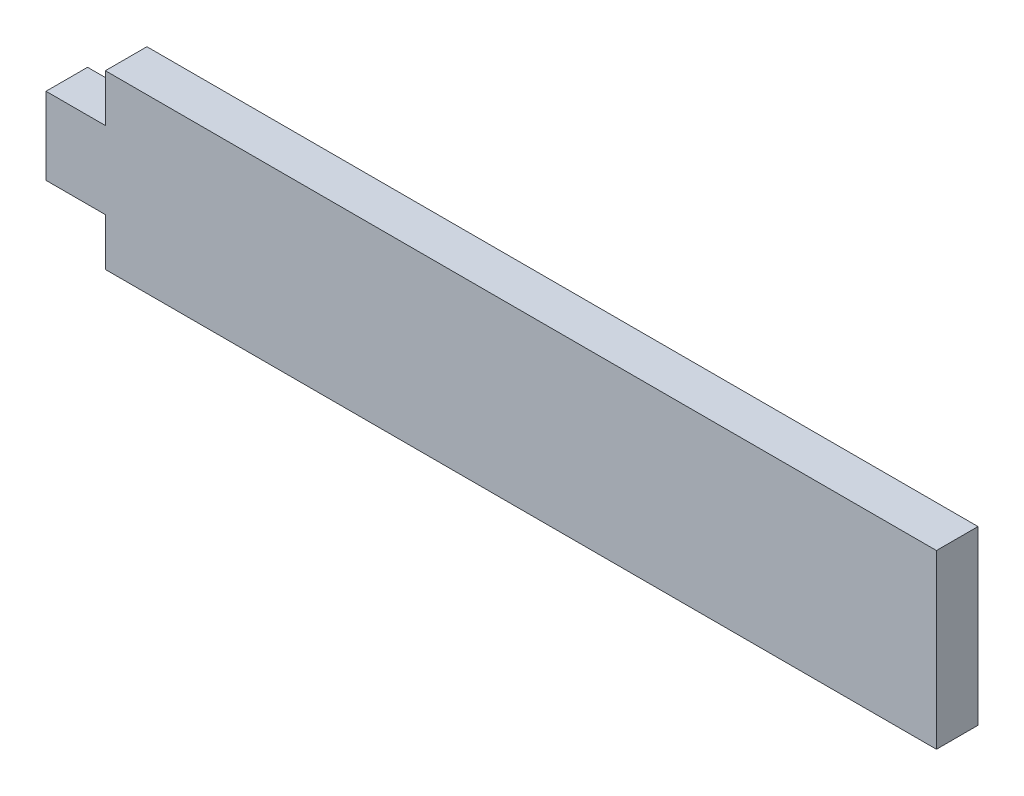
from build123d import *

# Parameters (mm, degrees)
CROQUIS1_W              = 1300
CROQUIS1_H              = 145
SALIENTE_EXTRUIR1_DEPTH = 35
CROQUIS2_W              = 35
CROQUIS2_H              = 145
CORTAR_EXTRUIR1_DEPTH   = 600
CROQUIS3_W              = 35
CROQUIS3_H              = 65
SALIENTE_EXTRUIR2_DEPTH = 50


with BuildPart() as part:
    # Croquis1 → Saliente-Extruir1 (new body)
    with BuildSketch(Plane.XY):
        Rectangle(CROQUIS1_W, CROQUIS1_H)
    extrude(amount=SALIENTE_EXTRUIR1_DEPTH)

    # Croquis2 → Cortar-Extruir1 (cut)
    with BuildSketch(Plane.ZY.offset(650)):
        with Locations((17.5, 0)):
            Rectangle(CROQUIS2_W, CROQUIS2_H)
    extrude(amount=-CORTAR_EXTRUIR1_DEPTH, mode=Mode.SUBTRACT)

    # Croquis3 → Saliente-Extruir2 (add)
    with BuildSketch(Plane.ZY.offset(50)):
        with Locations((17.5, 0)):
            Rectangle(CROQUIS3_W, CROQUIS3_H)
    extrude(amount=SALIENTE_EXTRUIR2_DEPTH)


solid = part.part
